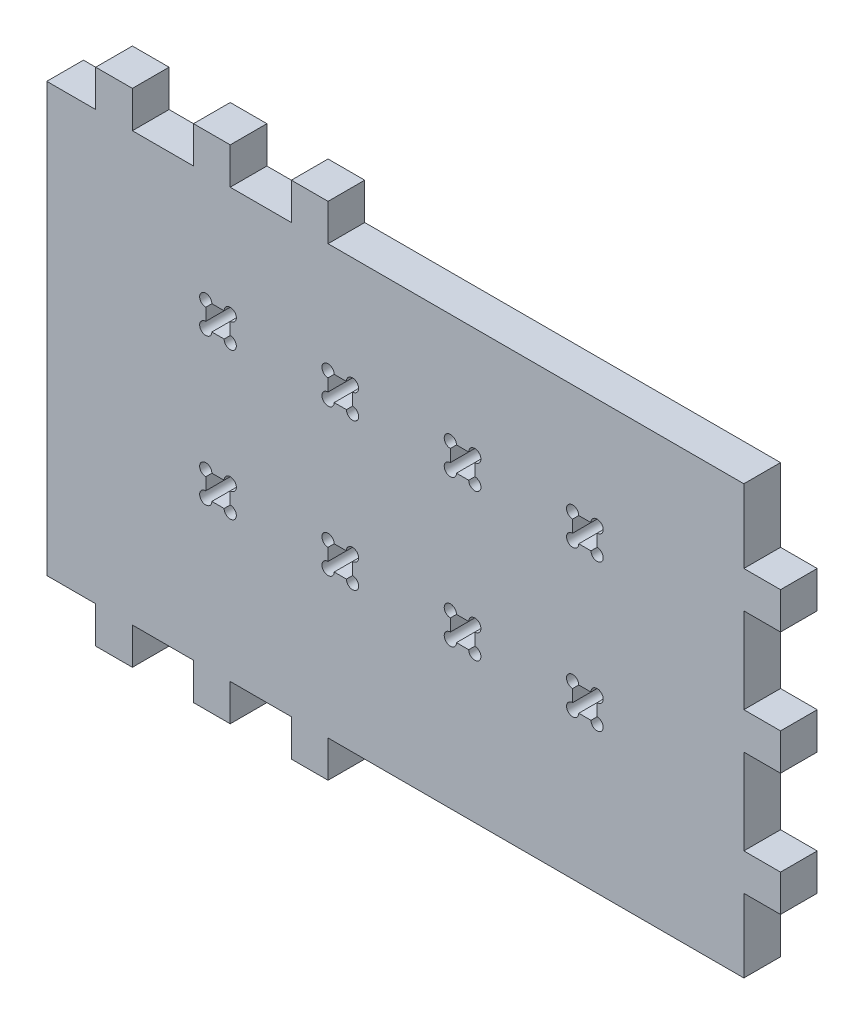
from build123d import *

# Parameters (mm, degrees)
SKETCH1_W               = 361.95
SKETCH1_H               = 222.25
BOSS_EXTRUDE1_DEPTH     = 19.05
SKETCH3_W               = 19.05
SKETCH3_H               = 19.05
BOSS_EXTRUDE4_DEPTH     = 19.05
SKETCH5_W               = 19.05
SKETCH5_H               = 19.05
BOSS_EXTRUDE5_DEPTH     = 19.05
CUT_EXTRUDE2_DEPTH      = 452.386300745
CUT_EXTRUDE2_DEPTH_BACK = 452.386300745


with BuildPart() as part:
    # Sketch1 → Boss-Extrude1 (new body)
    with BuildSketch(Plane.XY):
        with Locations((180.975, 111.125)):
            Rectangle(SKETCH1_W, SKETCH1_H)
    extrude(amount=-BOSS_EXTRUDE1_DEPTH)

    # Sketch3 → Boss-Extrude4 (add)
    with BuildSketch(Plane.XY):
        with Locations((34.925, 231.775)):
            Rectangle(SKETCH3_W, SKETCH3_H)
        with Locations((85.725, 231.775)):
            Rectangle(SKETCH3_W, SKETCH3_H)
        with Locations((136.525, 231.775)):
            Rectangle(SKETCH3_W, SKETCH3_H)
    boss_extrude4 = extrude(amount=-BOSS_EXTRUDE4_DEPTH)

    # Mirror1: Boss-Extrude4 across plane
    add(boss_extrude4.mirror(Plane.ZX.offset(111.125)))

    # Sketch5 → Boss-Extrude5 (add)
    with BuildSketch(Plane.XY):
        with Locations((371.475, 174.625)):
            Rectangle(SKETCH5_W, SKETCH5_H)
        with Locations((371.475, 47.625)):
            Rectangle(SKETCH5_W, SKETCH5_H)
        with Locations((371.475, 111.125)):
            Rectangle(SKETCH5_W, SKETCH5_H)
    extrude(amount=-BOSS_EXTRUDE5_DEPTH)

    # Sketch6 → Cut-Extrude2 (cut, two sides: drawn at the far end of the back side and taken through both)
    with BuildSketch(Plane.XY.offset(-CUT_EXTRUDE2_DEPTH_BACK)):
        with BuildLine():
            Line((85.725, 88.9), (92.075, 88.9))
            ThreePointArc((92.075, 88.9), (97.49506403, 91.14506403), (95.25, 85.725))
            Line((95.25, 85.725), (95.25, 79.375))
            ThreePointArc((95.25, 79.375), (97.49506403, 73.95493597), (92.075, 76.2))
            Line((92.075, 76.2), (85.725, 76.2))
            ThreePointArc((85.725, 76.2), (80.30493597, 73.95493597), (82.55, 79.375))
            Line((82.55, 79.375), (82.55, 85.725))
            ThreePointArc((82.55, 85.725), (80.30493597, 91.14506403), (85.725, 88.9))
        make_face()
        with BuildLine():
            Line((149.225, 76.2), (155.575, 76.2))
            ThreePointArc((155.575, 76.2), (160.99506403, 73.95493597), (158.75, 79.375))
            Line((158.75, 79.375), (158.75, 85.725))
            ThreePointArc((158.75, 85.725), (160.99506403, 91.14506403), (155.575, 88.9))
            Line((155.575, 88.9), (149.225, 88.9))
            ThreePointArc((149.225, 88.9), (143.80493597, 91.14506403), (146.05, 85.725))
            Line((146.05, 85.725), (146.05, 79.375))
            ThreePointArc((146.05, 79.375), (143.80493597, 73.95493597), (149.225, 76.2))
        make_face()
        with BuildLine():
            Line((212.725, 76.2), (219.075, 76.2))
            ThreePointArc((219.075, 76.2), (224.49506403, 73.95493597), (222.25, 79.375))
            Line((222.25, 79.375), (222.25, 85.725))
            ThreePointArc((222.25, 85.725), (224.49506403, 91.14506403), (219.075, 88.9))
            Line((219.075, 88.9), (212.725, 88.9))
            ThreePointArc((212.725, 88.9), (207.30493597, 91.14506403), (209.55, 85.725))
            Line((209.55, 85.725), (209.55, 79.375))
            ThreePointArc((209.55, 79.375), (207.30493597, 73.95493597), (212.725, 76.2))
        make_face()
        with BuildLine():
            Line((276.225, 76.2), (282.575, 76.2))
            ThreePointArc((282.575, 76.2), (287.99506403, 73.95493597), (285.75, 79.375))
            Line((285.75, 79.375), (285.75, 85.725))
            ThreePointArc((285.75, 85.725), (287.99506403, 91.14506403), (282.575, 88.9))
            Line((282.575, 88.9), (276.225, 88.9))
            ThreePointArc((276.225, 88.9), (270.80493597, 91.14506403), (273.05, 85.725))
            Line((273.05, 85.725), (273.05, 79.375))
            ThreePointArc((273.05, 79.375), (270.80493597, 73.95493597), (276.225, 76.2))
        make_face()
        with BuildLine():
            Line((149.225, 152.4), (155.575, 152.4))
            ThreePointArc((155.575, 152.4), (160.99506403, 150.15493597), (158.75, 155.575))
            Line((158.75, 155.575), (158.75, 161.925))
            ThreePointArc((158.75, 161.925), (160.99506403, 167.34506403), (155.575, 165.1))
            Line((155.575, 165.1), (149.225, 165.1))
            ThreePointArc((149.225, 165.1), (143.80493597, 167.34506403), (146.05, 161.925))
            Line((146.05, 161.925), (146.05, 155.575))
            ThreePointArc((146.05, 155.575), (143.80493597, 150.15493597), (149.225, 152.4))
        make_face()
        with BuildLine():
            Line((212.725, 152.4), (219.075, 152.4))
            ThreePointArc((219.075, 152.4), (224.49506403, 150.15493597), (222.25, 155.575))
            Line((222.25, 155.575), (222.25, 161.925))
            ThreePointArc((222.25, 161.925), (224.49506403, 167.34506403), (219.075, 165.1))
            Line((219.075, 165.1), (212.725, 165.1))
            ThreePointArc((212.725, 165.1), (207.30493597, 167.34506403), (209.55, 161.925))
            Line((209.55, 161.925), (209.55, 155.575))
            ThreePointArc((209.55, 155.575), (207.30493597, 150.15493597), (212.725, 152.4))
        make_face()
        with BuildLine():
            Line((276.225, 152.4), (282.575, 152.4))
            ThreePointArc((282.575, 152.4), (287.99506403, 150.15493597), (285.75, 155.575))
            Line((285.75, 155.575), (285.75, 161.925))
            ThreePointArc((285.75, 161.925), (287.99506403, 167.34506403), (282.575, 165.1))
            Line((282.575, 165.1), (276.225, 165.1))
            ThreePointArc((276.225, 165.1), (270.80493597, 167.34506403), (273.05, 161.925))
            Line((273.05, 161.925), (273.05, 155.575))
            ThreePointArc((273.05, 155.575), (270.80493597, 150.15493597), (276.225, 152.4))
        make_face()
        with BuildLine():
            Line((85.725, 152.4), (92.075, 152.4))
            ThreePointArc((92.075, 152.4), (97.49506403, 150.15493597), (95.25, 155.575))
            Line((95.25, 155.575), (95.25, 161.925))
            ThreePointArc((95.25, 161.925), (97.49506403, 167.34506403), (92.075, 165.1))
            Line((92.075, 165.1), (85.725, 165.1))
            ThreePointArc((85.725, 165.1), (80.30493597, 167.34506403), (82.55, 161.925))
            Line((82.55, 161.925), (82.55, 155.575))
            ThreePointArc((82.55, 155.575), (80.30493597, 150.15493597), (85.725, 152.4))
        make_face()
    extrude(amount=CUT_EXTRUDE2_DEPTH + CUT_EXTRUDE2_DEPTH_BACK, mode=Mode.SUBTRACT)


solid = part.part
